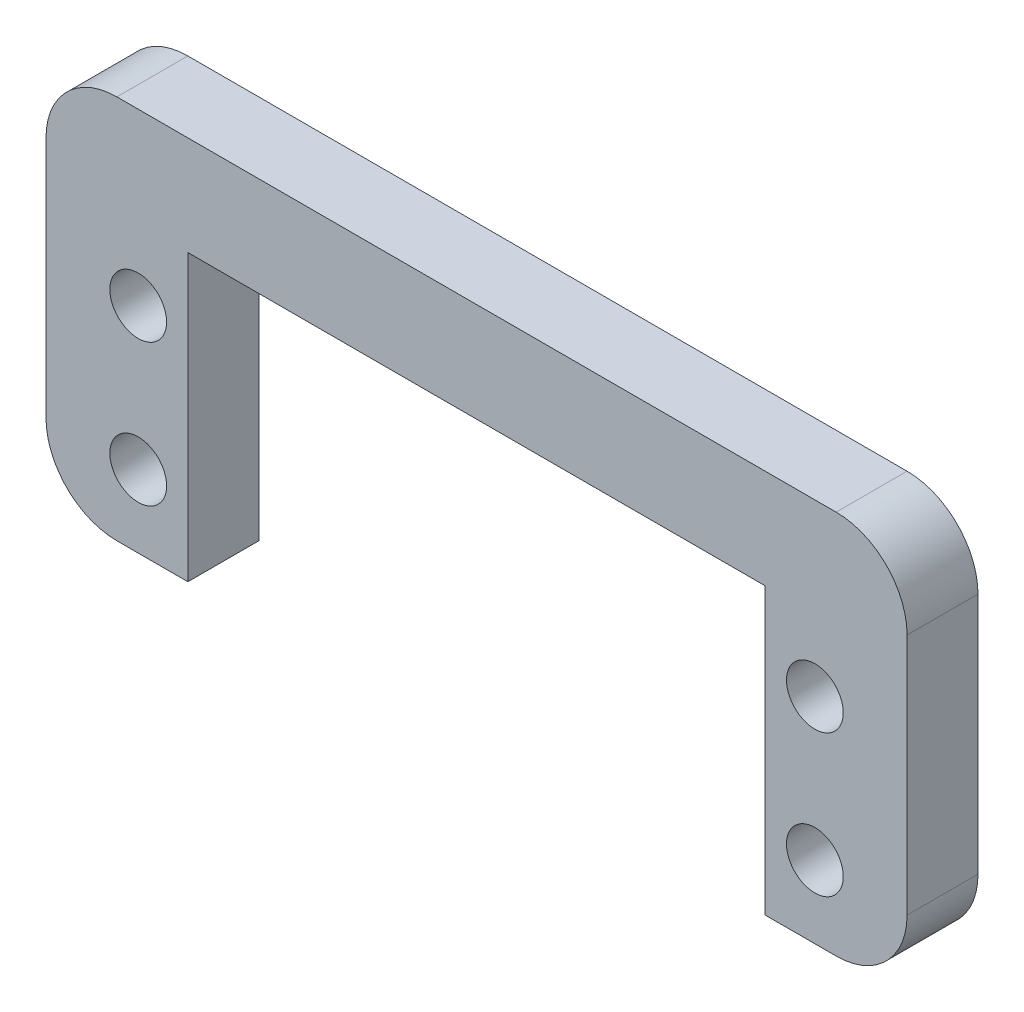
from build123d import *

# Parameters (mm, degrees)
SKETCH1_R           = 2
BOSS_EXTRUDE1_DEPTH = 5


with BuildPart() as part:
    # Sketch1 → Boss-Extrude1 (new body)
    with BuildSketch(Plane(origin=(0, 0, 0), x_dir=(0, 1, 0), z_dir=(0, 0, 1))):
        with BuildLine():
            Line((-10.05, 20.35), (10.05, 20.35))
            Line((10.05, 20.35), (10.05, -20.35))
            Line((10.05, -20.35), (-10.05, -20.35))
            Line((-10.05, -20.35), (-10.05, -25.35))
            ThreePointArc((-10.05, -25.35), (-8.585533906, -28.885533906), (-5.05, -30.35))
            Line((-5.05, -30.35), (12.05, -30.35))
            ThreePointArc((12.05, -30.35), (15.585533906, -28.885533906), (17.05, -25.35))
            Line((17.05, -25.35), (17.05, 25.35))
            ThreePointArc((17.05, 25.35), (15.585533906, 28.885533906), (12.05, 30.35))
            Line((12.05, 30.35), (-5.05, 30.35))
            ThreePointArc((-5.05, 30.35), (-8.585533906, 28.885533906), (-10.05, 25.35))
            Line((-10.05, 25.35), (-10.05, 20.35))
        make_face()
        with Locations(Location((5.05, 23.85, 0), (0, 0, 270))):
            Circle(SKETCH1_R, mode=Mode.SUBTRACT)
        with Locations(Location((-4.95, 23.85, 0), (0, 0, 270))):
            Circle(SKETCH1_R, mode=Mode.SUBTRACT)
        with Locations(Location((5.05, -23.85, 0), (0, 0, 90))):
            Circle(SKETCH1_R, mode=Mode.SUBTRACT)
        with Locations(Location((-4.95, -23.85, 0), (0, 0, 90))):
            Circle(SKETCH1_R, mode=Mode.SUBTRACT)
    extrude(amount=-BOSS_EXTRUDE1_DEPTH)


solid = part.part
